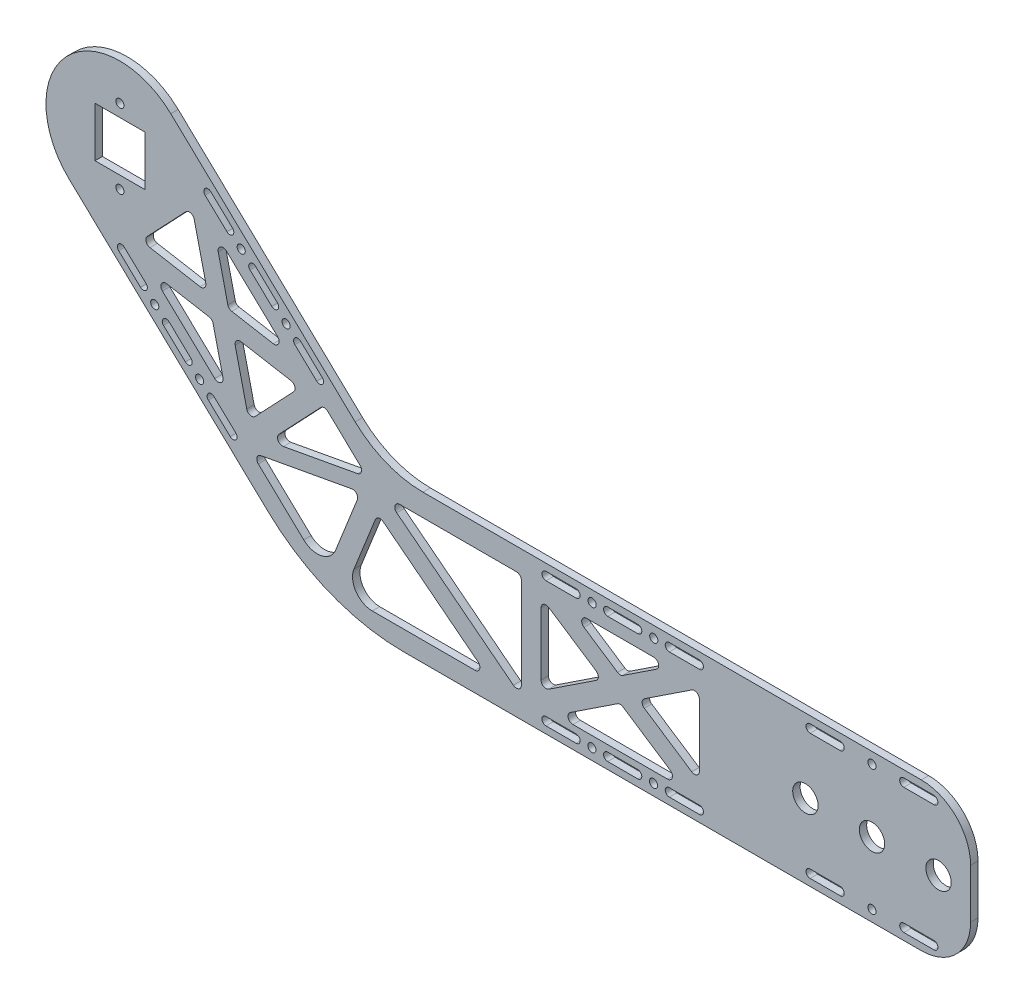
from build123d import *

# Parameters (mm, degrees)
SKETCH_1_R          = 7.65
EXTRUDE_1_DEPTH     = 3
SKETCH_2_R          = 5.15
CUT_EXTRUDE_1_DEPTH = 366.286189172
FILLET_1_R          = 20
SKETCH_3_R          = 1.65
CUT_EXTRUDE_2_DEPTH = 366.286189172
FILLET_2_R          = 40
FILLET_3_R          = 80
CUT_EXTRUDE_3_DEPTH = 366.286189172
FILLET_4_R          = 2
FILLET_5_R          = 8
SKETCH_5_R          = 1.65
SKETCH_5_W          = 20.2
SKETCH_5_H          = 20.2
CUT_EXTRUDE_4_DEPTH = 366.286189172


with BuildPart() as part:
    # 草图1 → 凸台-拉伸1 (new body)
    with BuildSketch(Plane.XY):
        with BuildLine():
            Line((106.954174428, -60), (20.632339437, 21.778580517))
            ThreePointArc((20.632339437, 21.778580517), (-21.778580517, 20.632339437), (-20.632339437, -21.778580517))
            Line((-20.632339437, -21.778580517), (83.045825572, -120))
            Line((83.045825572, -120), (345, -120))
            Line((345, -120), (345, -60))
            Line((345, -60), (106.954174428, -60))
        make_face()
        Circle(SKETCH_1_R, mode=Mode.SUBTRACT)
    extrude(amount=EXTRUDE_1_DEPTH)

    # 草图2 → 切除-拉伸1 (cut, through all)
    with BuildSketch(Plane.XY.offset(3)):
        with Locations((305, -90)):
            Circle(SKETCH_2_R)
        with Locations((278, -90)):
            Circle(SKETCH_2_R)
        with Locations((332, -90)):
            Circle(SKETCH_2_R)
    extrude(amount=-CUT_EXTRUDE_1_DEPTH, mode=Mode.SUBTRACT)

    # 圆角1
    fillet_1_edges = [part.edges().sort_by_distance(p)[0] for p in [
        (345, -60, 1.5),
        (345, -120, 1.5),
    ]]
    fillet(fillet_1_edges, radius=FILLET_1_R)

    # 草图3 → 切除-拉伸2 (cut, through all)
    with BuildSketch(Plane.XY.offset(3)):
        with Locations((216.4, -115.5)):
            Circle(SKETCH_3_R)
        with Locations((216.5, -64.5)):
            Circle(SKETCH_3_R)
        with Locations((191.5, -64.5)):
            Circle(SKETCH_3_R)
        with Locations((191.4, -115.5)):
            Circle(SKETCH_3_R)
        with Locations((14.114048497, -48.497460089)):
            Circle(SKETCH_3_R)
        with Locations((49.18902554, -11.473873209)):
            Circle(SKETCH_3_R)
        with Locations((67.385880926, -28.616640024)):
            Circle(SKETCH_3_R)
        with Locations((32.310903883, -65.640226903)):
            Circle(SKETCH_3_R)
        with Locations((305, -64.5)):
            Circle(SKETCH_3_R)
        with Locations(Location((305, -115.5, 0), (0, 0, 180))):
            Circle(SKETCH_3_R)
        with BuildLine():
            Line((222.8, -113.85), (235, -113.85))
            ThreePointArc((235, -113.85), (236.65, -115.5), (235, -117.15))
            Line((235, -117.15), (222.8, -117.15))
            ThreePointArc((222.8, -117.15), (221.15, -115.5), (222.8, -113.85))
        make_face()
        with BuildLine():
            Line((222.8, -66.15), (235, -66.15))
            ThreePointArc((235, -66.15), (236.65, -64.5), (235, -62.85))
            Line((235, -62.85), (222.8, -62.85))
            ThreePointArc((222.8, -62.85), (221.15, -64.5), (222.8, -66.15))
        make_face()
        with BuildLine():
            Line((36.821084288, 2.51599917), (45.677707032, -5.874485534))
            ThreePointArc((45.677707032, -5.874485534), (45.740750291, -8.207086132), (43.408149694, -8.270129391))
            Line((43.408149694, -8.270129391), (34.55152695, 0.120355313))
            ThreePointArc((34.55152695, 0.120355313), (34.488483691, 2.452955911), (36.821084288, 2.51599917))
        make_face()
        with BuildLine():
            Line((19.942962631, -51.650354523), (28.799585375, -60.040839228))
            ThreePointArc((28.799585375, -60.040839228), (28.862628634, -62.373439825), (26.530028037, -62.436483085))
            Line((26.530028037, -62.436483085), (17.673405293, -54.04599838))
            ThreePointArc((17.673405293, -54.04599838), (17.610362034, -51.713397783), (19.942962631, -51.650354523))
        make_face()
        with BuildLine():
            Line((197.8, -113.85), (210, -113.85))
            ThreePointArc((210, -113.85), (211.65, -115.5), (210, -117.15))
            Line((210, -117.15), (197.8, -117.15))
            ThreePointArc((197.8, -117.15), (196.15, -115.5), (197.8, -113.85))
        make_face()
        with BuildLine():
            Line((197.8, -66.15), (210, -66.15))
            ThreePointArc((210, -66.15), (211.65, -64.5), (210, -62.85))
            Line((210, -62.85), (197.8, -62.85))
            ThreePointArc((197.8, -62.85), (196.15, -64.5), (197.8, -66.15))
        make_face()
        with BuildLine():
            Line((172.8, -113.85), (185, -113.85))
            ThreePointArc((185, -113.85), (186.65, -115.5), (185, -117.15))
            Line((185, -117.15), (172.8, -117.15))
            ThreePointArc((172.8, -117.15), (171.15, -115.5), (172.8, -113.85))
        make_face()
        with BuildLine():
            Line((172.8, -66.15), (185, -66.15))
            ThreePointArc((185, -66.15), (186.65, -64.5), (185, -62.85))
            Line((185, -62.85), (172.8, -62.85))
            ThreePointArc((172.8, -62.85), (171.15, -64.5), (172.8, -66.15))
        make_face()
        with BuildLine():
            Line((1.746107245, -34.507587709), (10.602729989, -42.898072413))
            ThreePointArc((10.602729989, -42.898072413), (10.665773248, -45.230673011), (8.333172651, -45.29371627))
            Line((8.333172651, -45.29371627), (-0.523450093, -36.903231566))
            ThreePointArc((-0.523450093, -36.903231566), (-0.586493353, -34.570630968), (1.746107245, -34.507587709))
        make_face()
        with BuildLine():
            Line((55.017939675, -14.626767644), (63.874562418, -23.017252349))
            ThreePointArc((63.874562418, -23.017252349), (63.937605678, -25.349852946), (61.60500508, -25.412896206))
            Line((61.60500508, -25.412896206), (52.748382337, -17.022411501))
            ThreePointArc((52.748382337, -17.022411501), (52.685339077, -14.689810904), (55.017939675, -14.626767644))
        make_face()
        with BuildLine():
            Line((38.139818017, -68.793121338), (46.996440761, -77.183606042))
            ThreePointArc((46.996440761, -77.183606042), (47.05948402, -79.51620664), (44.726883423, -79.579249899))
            Line((44.726883423, -79.579249899), (35.870260679, -71.188765195))
            ThreePointArc((35.870260679, -71.188765195), (35.80721742, -68.856164597), (38.139818017, -68.793121338))
        make_face()
        with BuildLine():
            Line((73.214795061, -31.769534459), (82.071417805, -40.160019163))
            ThreePointArc((82.071417805, -40.160019163), (82.134461064, -42.492619761), (79.801860466, -42.55566302))
            Line((79.801860466, -42.55566302), (70.945237723, -34.165178315))
            ThreePointArc((70.945237723, -34.165178315), (70.882194463, -31.832577718), (73.214795061, -31.769534459))
        make_face()
        with BuildLine():
            Line((330.1, -66.15), (317.9, -66.15))
            ThreePointArc((317.9, -66.15), (316.25, -64.5), (317.9, -62.85))
            Line((317.9, -62.85), (330.1, -62.85))
            ThreePointArc((330.1, -62.85), (331.75, -64.5), (330.1, -66.15))
        make_face()
        with BuildLine():
            Line((330.1, -113.85), (317.9, -113.85))
            ThreePointArc((317.9, -113.85), (316.25, -115.5), (317.9, -117.15))
            Line((317.9, -117.15), (330.1, -117.15))
            ThreePointArc((330.1, -117.15), (331.75, -115.5), (330.1, -113.85))
        make_face()
        with BuildLine():
            Line((279.9, -62.85), (292.1, -62.85))
            ThreePointArc((292.1, -62.85), (293.75, -64.5), (292.1, -66.15))
            Line((292.1, -66.15), (279.9, -66.15))
            ThreePointArc((279.9, -66.15), (278.25, -64.5), (279.9, -62.85))
        make_face()
        with BuildLine():
            Line((279.9, -113.85), (292.1, -113.85))
            ThreePointArc((292.1, -113.85), (293.75, -115.5), (292.1, -117.15))
            Line((292.1, -117.15), (279.9, -117.15))
            ThreePointArc((279.9, -117.15), (278.25, -115.5), (279.9, -113.85))
        make_face()
    extrude(amount=-CUT_EXTRUDE_2_DEPTH, mode=Mode.SUBTRACT)

    # 圆角2
    fillet_2_edges = [part.edges().sort_by_distance(p)[0] for p in [
        (106.954174428, -60, 1.5),
    ]]
    fillet(fillet_2_edges, radius=FILLET_2_R)

    # 圆角3
    fillet_3_edges = [part.edges().sort_by_distance(p)[0] for p in [
        (83.045825572, -120, 1.5),
    ]]
    fillet(fillet_3_edges, radius=FILLET_3_R)

    # 草图4 → 切除-拉伸3 (cut, through all)
    with BuildSketch(Plane.XY.offset(3)):
        Polygon((170.8, -105.752549487), (170.8, -72.926120873), (195.643481613, -89.33933518), align=None)
        Polygon((107.673788457, -69), (162.8, -69), (162.8, -112), align=None)
        Polygon((182.624652559, -71.15), (202.9, -84.545208767), (223.175347441, -71.15), align=None)
        Polygon((210.156518387, -89.33933518), (235, -72.926120873), (235, -105.752549487), align=None)
        Polygon((177.062550258, -111.203355675), (202.9, -94.133461594), (228.737449742, -111.203355675), align=None)
        Polygon((104.589547434, -76.740160666), (149.792834925, -112), (90.539471777, -112), align=None)
        Polygon((83.107750181, -109.038663458), (97.619712786, -72.619680215), (53.254218477, -80.756370264), align=None)
        Polygon((60.248478543, -73.373540194), (82.827238337, -49.540404857), (100.242066861, -66.038663458), align=None)
        Polygon((8.506354445, -28.825799256), (35.499367886, -33.548104686), (29.265054045, -6.913838568), align=None)
        Polygon((12.415001138, -37.631100304), (37.481546744, -42.016378913), (43.304983555, -66.895294173), align=None)
        Polygon((38.334111759, -10.557272346), (44.066420967, -35.046871816), (68.740714664, -39.36352773), align=None)
        Polygon((46.048599826, -43.515146043), (73.041613266, -48.237451473), (52.282913666, -70.149412161), align=None)
    extrude(amount=-CUT_EXTRUDE_3_DEPTH, mode=Mode.SUBTRACT)

    # 圆角4
    fillet_4_edges = [part.edges().sort_by_distance(p)[0] for p in [
        (53.254218477, -80.756370264, 1.5),
        (97.619712786, -72.619680215, 1.5),
        (104.589547434, -76.740160666, 1.5),
        (149.792834925, -112, 1.5),
        (100.242066861, -66.038663458, 1.5),
        (60.248478543, -73.373540194, 1.5),
        (82.827238337, -49.540404857, 1.5),
        (8.506354445, -28.825799256, 1.5),
        (29.265054045, -6.913838568, 1.5),
        (35.499367886, -33.548104686, 1.5),
        (235, -105.752549487, 1.5),
        (210.156518387, -89.33933518, 1.5),
        (235, -72.926120873, 1.5),
        (182.624652559, -71.15, 1.5),
        (223.175347441, -71.15, 1.5),
        (202.9, -84.545208767, 1.5),
        (228.737449742, -111.203355675, 1.5),
        (177.062550258, -111.203355675, 1.5),
        (202.9, -94.133461594, 1.5),
        (162.8, -112, 1.5),
        (107.673788457, -69, 1.5),
        (162.8, -69, 1.5),
        (52.282913666, -70.149412161, 1.5),
        (46.048599826, -43.515146043, 1.5),
        (73.041613266, -48.237451473, 1.5),
        (43.304983555, -66.895294173, 1.5),
        (12.415001138, -37.631100304, 1.5),
        (37.481546744, -42.016378913, 1.5),
        (38.334111759, -10.557272346, 1.5),
        (68.740714664, -39.36352773, 1.5),
        (44.066420967, -35.046871816, 1.5),
        (195.643481613, -89.33933518, 1.5),
        (170.8, -105.752549487, 1.5),
        (170.8, -72.926120873, 1.5),
    ]]
    fillet(fillet_4_edges, radius=FILLET_4_R)

    # 圆角5
    fillet_5_edges = [part.edges().sort_by_distance(p)[0] for p in [
        (83.107750181, -109.038663458, 1.5),
        (90.539471777, -112, 1.5),
    ]]
    fillet(fillet_5_edges, radius=FILLET_5_R)

    # 草图5 → 切除-拉伸4 (cut, through all)
    with BuildSketch(Plane.XY.offset(3)):
        with Locations((0, 15.1)):
            Circle(SKETCH_5_R)
        with Locations((0, -15.1)):
            Circle(SKETCH_5_R)
        Rectangle(SKETCH_5_W, SKETCH_5_H)
    extrude(amount=-CUT_EXTRUDE_4_DEPTH, mode=Mode.SUBTRACT)


solid = part.part
